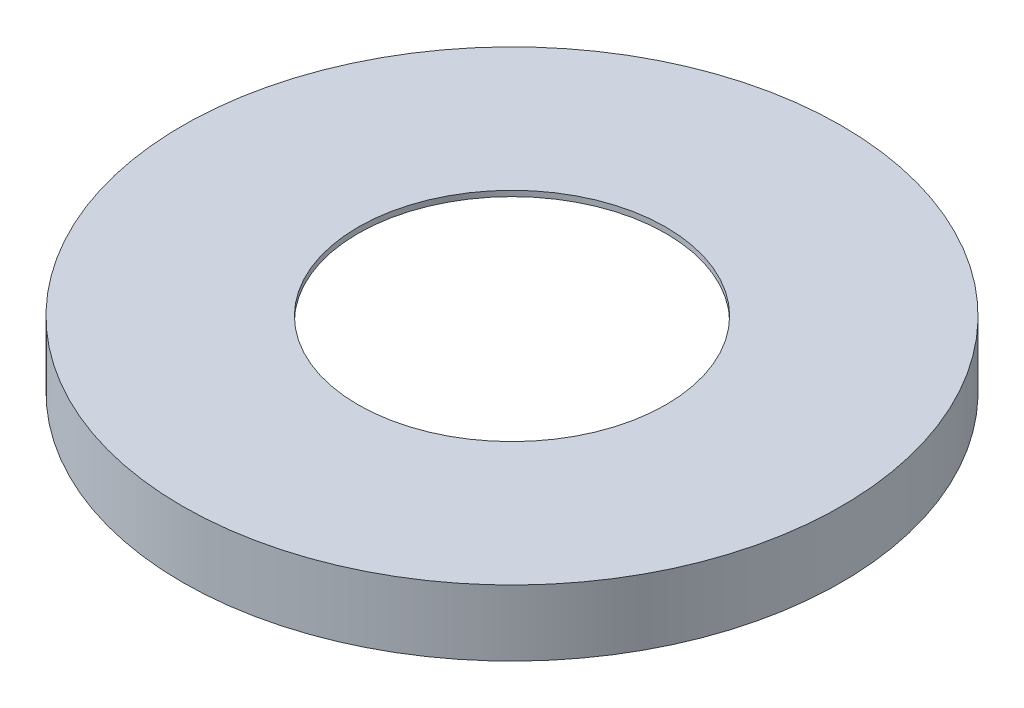
from build123d import *

# Parameters (mm, degrees)
SKETCH1_R           = 30
SKETCH1_R_2         = 14.01
BOSS_EXTRUDE1_DEPTH = 6
SKETCH2_R           = 29
CUT_EXTRUDE1_DEPTH  = 5.5


with BuildPart() as part:
    # Sketch1 → Boss-Extrude1 (new body)
    with BuildSketch(Plane(origin=(0, 0, 0), x_dir=(1, 0, 0), z_dir=(0, 1, 0))):
        with Locations(Location((0, 0, 0), (0, 0, 270))):
            Circle(SKETCH1_R)
        with Locations(Location((0, 0, 0), (0, 0, 270))):
            Circle(SKETCH1_R_2, mode=Mode.SUBTRACT)
    extrude(amount=BOSS_EXTRUDE1_DEPTH)

    # Sketch2 → Cut-Extrude1 (cut)
    with BuildSketch(Plane.XZ):
        with Locations(Location((0, 0, 0), (0, 0, 270))):
            Circle(SKETCH2_R)
    extrude(amount=-CUT_EXTRUDE1_DEPTH, mode=Mode.SUBTRACT)


solid = part.part
